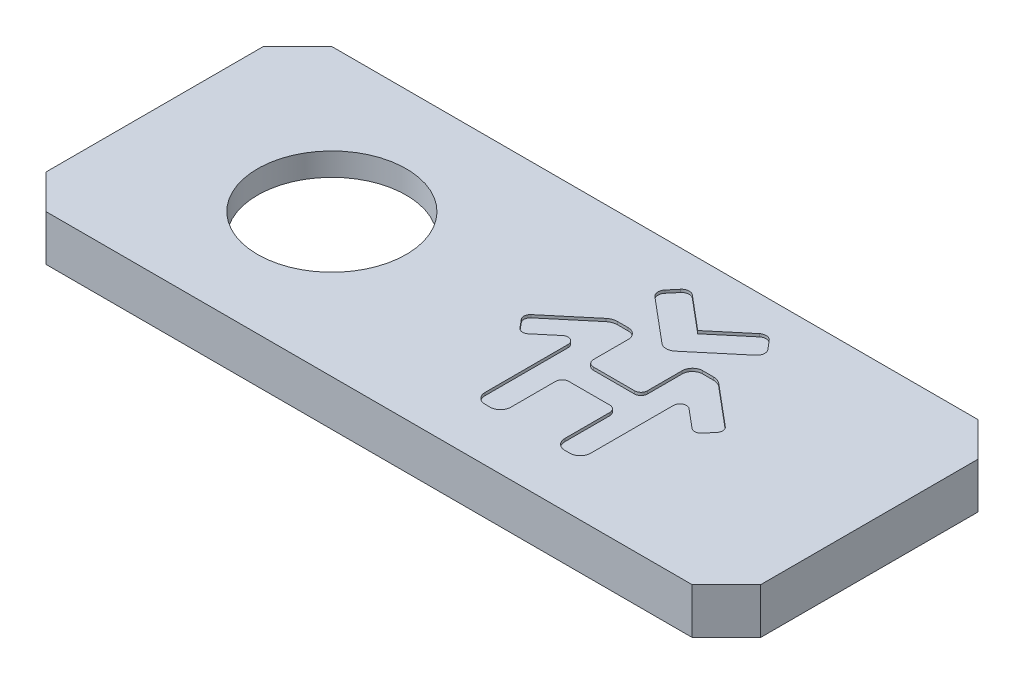
from build123d import *

# Parameters (mm, degrees)
SKETCH_1_R          = 1.45
EXTRUDE_1_DEPTH     = 2
EXTRUDE_2_DEPTH     = 2
SKETCH_3_R          = 6.5
CUT_EXTRUDE_1_DEPTH = 2
SKETCH_4_R          = 1.45
CUT_EXTRUDE_2_DEPTH = 1
CUT_EXTRUDE_3_DEPTH = 0.25


with BuildPart() as part:
    # Эскиз1 → Бобышка-Вытянуть1 (new body)
    with BuildSketch(Plane(origin=(0, 0, 0), x_dir=(1, 0, 0), z_dir=(0, 1, 0))):
        Polygon((35.593108597, -12.265362584), (35.593108597, 6.734637416), (32.593108597, 9.734637416), (-23.906891403, 9.734637416), (-26.906891403, 6.734637416), (-26.906891403, -12.265362584), (-23.906891403, -15.265362584), (32.593108597, -15.265362584), align=None)
        with Locations(Location((-22.906891403, -11.765362584, 0), (0, 0, 270))):
            Circle(SKETCH_1_R, mode=Mode.SUBTRACT)
        with BuildLine():
            Line((25.893108597, 8.234637416), (-15.606891403, 8.234637416))
            Line((-15.606891403, 8.234637416), (-24.906891403, 2.234637416))
            Line((-24.906891403, 2.234637416), (-24.906891403, -8.765362584))
            Line((-24.906891403, -8.765362584), (-15.008932433, -13.765362584))
            Line((-15.008932433, -13.765362584), (26.491067567, -13.765362584))
            Line((26.491067567, -13.765362584), (33.593108597, -10.265362584))
            Line((33.593108597, -10.265362584), (33.593108597, 4.734637416))
            Line((33.593108597, 4.734637416), (32.596332637, 5.187717397))
            ThreePointArc((32.596332637, 5.187717397), (32.193122866, 7.554668808), (30.144679077, 6.302105379))
            Line((30.144679077, 6.302105379), (25.893108597, 8.234637416))
        make_face(mode=Mode.SUBTRACT)
    extrude(amount=EXTRUDE_1_DEPTH)

    # Эскиз2 → Бобышка-Вытянуть2 (add)
    with BuildSketch(Plane(origin=(0, 2, 0), x_dir=(1, 0, 0), z_dir=(0, 1, 0))):
        Polygon((32.593108597, -15.265362584), (35.593108597, -12.265362584), (35.593108597, 6.734637416), (32.593108597, 9.734637416), (-23.906891403, 9.734637416), (-26.906891403, 6.734637416), (-26.906891403, -12.265362584), (-23.906891403, -15.265362584), align=None)
    extrude(amount=EXTRUDE_2_DEPTH)

    # Эскиз3 → Вырез-Вытянуть1 (cut)
    with BuildSketch(Plane(origin=(0, 4, 0), x_dir=(1, 0, 0), z_dir=(0, 1, 0))):
        with Locations(Location((-11.406891403, -2.765362584, 0), (0, 0, 270))):
            Circle(SKETCH_3_R)
    extrude(amount=-CUT_EXTRUDE_1_DEPTH, mode=Mode.SUBTRACT)

    # Эскиз4 → Вырез-Вытянуть2 (cut)
    with BuildSketch(Plane.XZ.offset(-2)):
        with Locations(Location((31.593108597, -6.234637416, 0), (0, 0, 270))):
            Circle(SKETCH_4_R)
        with Locations(Location((-22.906891403, 11.765362584, 0), (0, 0, 270))):
            Circle(SKETCH_4_R)
    extrude(amount=-CUT_EXTRUDE_2_DEPTH, mode=Mode.SUBTRACT)

    # Эскиз5 → Вырез-Вытянуть3 (cut)
    with BuildSketch(Plane(origin=(0, 4, 0), x_dir=(1, 0, 0), z_dir=(0, 1, 0))):
        with BuildLine():
            Line((8.980608597, -2.500998747), (8.980608597, -9.758351134))
            ThreePointArc((8.980608597, -9.758351134), (9.244212494, -10.394747237), (9.880608597, -10.658351134))
            Line((9.880608597, -10.658351134), (10.330608597, -10.658351134))
            ThreePointArc((10.330608597, -10.658351134), (10.9670047, -10.394747237), (11.230608597, -9.758351134))
            Line((11.230608597, -9.758351134), (11.230608597, -5.827862584))
            ThreePointArc((11.230608597, -5.827862584), (11.395361032, -5.43011502), (11.793108597, -5.265362584))
            Line((11.793108597, -5.265362584), (15.393108597, -5.265362584))
            ThreePointArc((15.393108597, -5.265362584), (15.790856161, -5.43011502), (15.955608597, -5.827862584))
            Line((15.955608597, -5.827862584), (15.955608597, -9.758351134))
            ThreePointArc((15.955608597, -9.758351134), (16.219212494, -10.394747237), (16.855608597, -10.658351134))
            Line((16.855608597, -10.658351134), (17.305608597, -10.658351134))
            ThreePointArc((17.305608597, -10.658351134), (17.9420047, -10.394747237), (18.205608597, -9.758351134))
            Line((18.205608597, -9.758351134), (18.205608597, -2.500998747))
            ThreePointArc((18.205608597, -2.500998747), (18.530385824, -1.991200617), (19.129676627, -2.070098747))
            Line((19.129676627, -2.070098747), (20.756009257, -3.434753858))
            ThreePointArc((20.756009257, -3.434753858), (21.166602393, -3.564213376), (21.548477287, -3.365421889))
            Line((21.548477287, -3.365421889), (22.153040559, -2.644931438))
            ThreePointArc((22.153040559, -2.644931438), (22.282500077, -2.234338302), (22.08370859, -1.852463408))
            Line((22.08370859, -1.852463408), (18.519278144, 1.138448864))
            ThreePointArc((18.519278144, 1.138448864), (18.180914744, 1.333803064), (17.796142083, 1.401648866))
            Line((17.796142083, 1.401648866), (16.855608597, 1.401648866))
            ThreePointArc((16.855608597, 1.401648866), (16.219212494, 1.138044969), (15.955608597, 0.501648866))
            Line((15.955608597, 0.501648866), (15.955608597, -2.535851134))
            ThreePointArc((15.955608597, -2.535851134), (15.790856161, -2.933598699), (15.393108597, -3.098351134))
            Line((15.393108597, -3.098351134), (11.793108597, -3.098351134))
            ThreePointArc((11.793108597, -3.098351134), (11.395361032, -2.933598699), (11.230608597, -2.535851134))
            Line((11.230608597, -2.535851134), (11.230608597, 0.501648866))
            ThreePointArc((11.230608597, 0.501648866), (10.9670047, 1.138044969), (10.330608597, 1.401648866))
            Line((10.330608597, 1.401648866), (9.39007511, 1.401648866))
            ThreePointArc((9.39007511, 1.401648866), (9.005302449, 1.333803064), (8.666939049, 1.138448864))
            Line((8.666939049, 1.138448864), (5.102508603, -1.852463408))
            ThreePointArc((5.102508603, -1.852463408), (4.903717116, -2.234338302), (5.033176634, -2.644931438))
            Line((5.033176634, -2.644931438), (5.637739906, -3.365421889))
            ThreePointArc((5.637739906, -3.365421889), (6.0196148, -3.564213376), (6.430207936, -3.434753858))
            Line((6.430207936, -3.434753858), (8.056540566, -2.070098747))
            ThreePointArc((8.056540566, -2.070098747), (8.655831369, -1.991200617), (8.980608597, -2.500998747))
        make_face()
        with BuildLine():
            Line((13.593108597, 4.226315266), (10.66501019, 6.683281559))
            ThreePointArc((10.66501019, 6.683281559), (10.172298427, 6.838632981), (9.714048554, 6.600083196))
            Line((9.714048554, 6.600083196), (9.08803108, 5.854024623))
            ThreePointArc((9.08803108, 5.854024623), (8.932679658, 5.36131286), (9.171229443, 4.903062987))
            Line((9.171229443, 4.903062987), (13.014599748, 1.678092382))
            ThreePointArc((13.014599748, 1.678092382), (13.593108597, 1.467532381), (14.171617445, 1.678092382))
            Line((14.171617445, 1.678092382), (18.01498775, 4.903062987))
            ThreePointArc((18.01498775, 4.903062987), (18.253537535, 5.36131286), (18.098186113, 5.854024623))
            Line((18.098186113, 5.854024623), (17.472168639, 6.600083196))
            ThreePointArc((17.472168639, 6.600083196), (17.013918766, 6.838632981), (16.521207003, 6.683281559))
            Line((16.521207003, 6.683281559), (13.593108597, 4.226315266))
        make_face()
    extrude(amount=-CUT_EXTRUDE_3_DEPTH, mode=Mode.SUBTRACT)


solid = part.part
